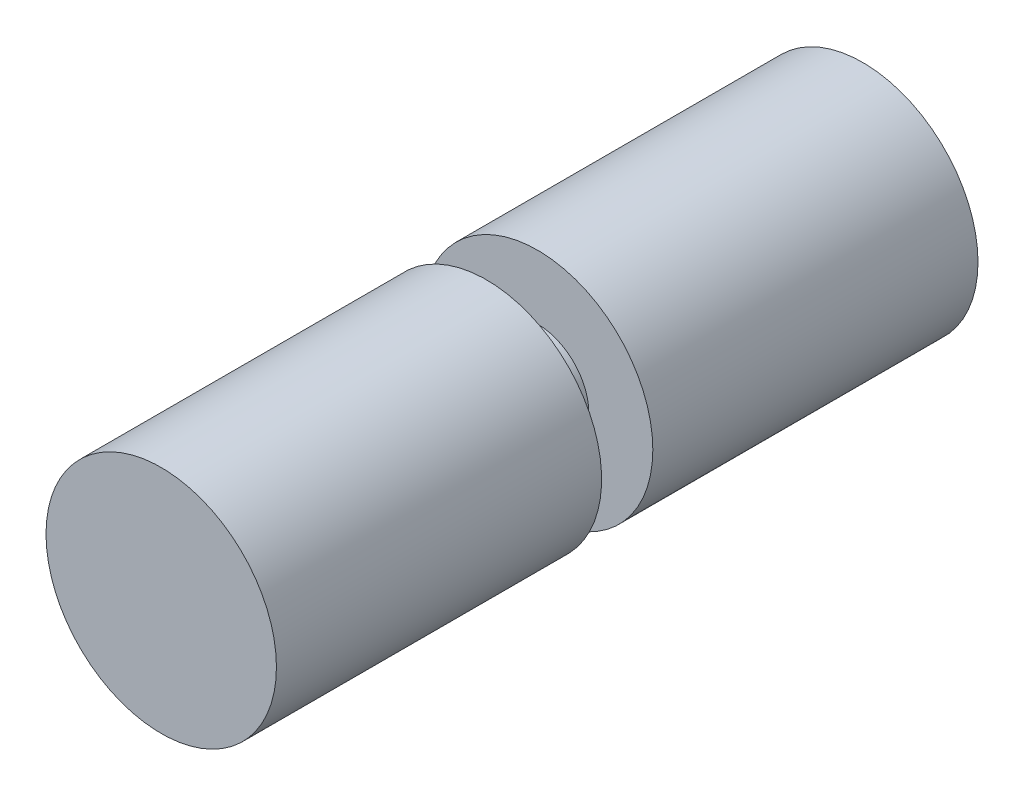
from build123d import *
from build123d.topology import SkipClean

# Parameters (mm, degrees)
SKETCH1_R           = 22.5
BOSS_EXTRUDE1_DEPTH = 66
SKETCH2_R           = 10
BOSS_EXTRUDE2_DEPTH = 5
SKETCH3_R           = 22.5
BOSS_EXTRUDE3_DEPTH = 66
SKETCH4_R           = 22.5
SKETCH4_R_2         = 10
CUT_EXTRUDE2_DEPTH  = 2.5
CUT_EXTRUDE3_START  = -2.5
SKETCH5_R           = 22.5
SKETCH5_R_2         = 10
CUT_EXTRUDE3_DEPTH  = 2.5


with BuildPart() as part:
    # Sketch1 → Boss-Extrude1 (new body)
    with BuildSketch(Plane.XY):
        Circle(SKETCH1_R)
    extrude(amount=BOSS_EXTRUDE1_DEPTH)

    # Sketch2 → Boss-Extrude2 (add)
    with BuildSketch(Plane.XY.offset(66)):
        Circle(SKETCH2_R)
    extrude(amount=BOSS_EXTRUDE2_DEPTH)

    # Sketch3 → Boss-Extrude3 (add)
    with BuildSketch(Plane.XY.offset(71)):
        Circle(SKETCH3_R)
    extrude(amount=BOSS_EXTRUDE3_DEPTH)

    # Sketch4 → Cut-Extrude2 (cut)
    with SkipClean():  # the faces are left unmerged after this step: merging them gives an invalid solid
        with BuildSketch(Plane(origin=(0, 0, 71), x_dir=(-1, 0, 0), z_dir=(0, 0, -1))):
            with Locations(Location((0, 0, 0), (0, 0, 180))):
                Circle(SKETCH4_R)
            Circle(SKETCH4_R_2, mode=Mode.SUBTRACT)
        extrude(amount=-CUT_EXTRUDE2_DEPTH, mode=Mode.SUBTRACT)

    # Sketch5 → Cut-Extrude3 (cut)
    with SkipClean():  # the faces are left unmerged after this step: merging them gives an invalid solid
        with BuildSketch(Plane.XY.offset(66).offset(CUT_EXTRUDE3_START)):
            with Locations(Location((0, 0, 0), (0, 0, 180))):
                Circle(SKETCH5_R)
            with Locations(Location((0, 0, 0), (0, 0, 180))):
                Circle(SKETCH5_R_2, mode=Mode.SUBTRACT)
        extrude(amount=CUT_EXTRUDE3_DEPTH, mode=Mode.SUBTRACT)


solid = part.part
